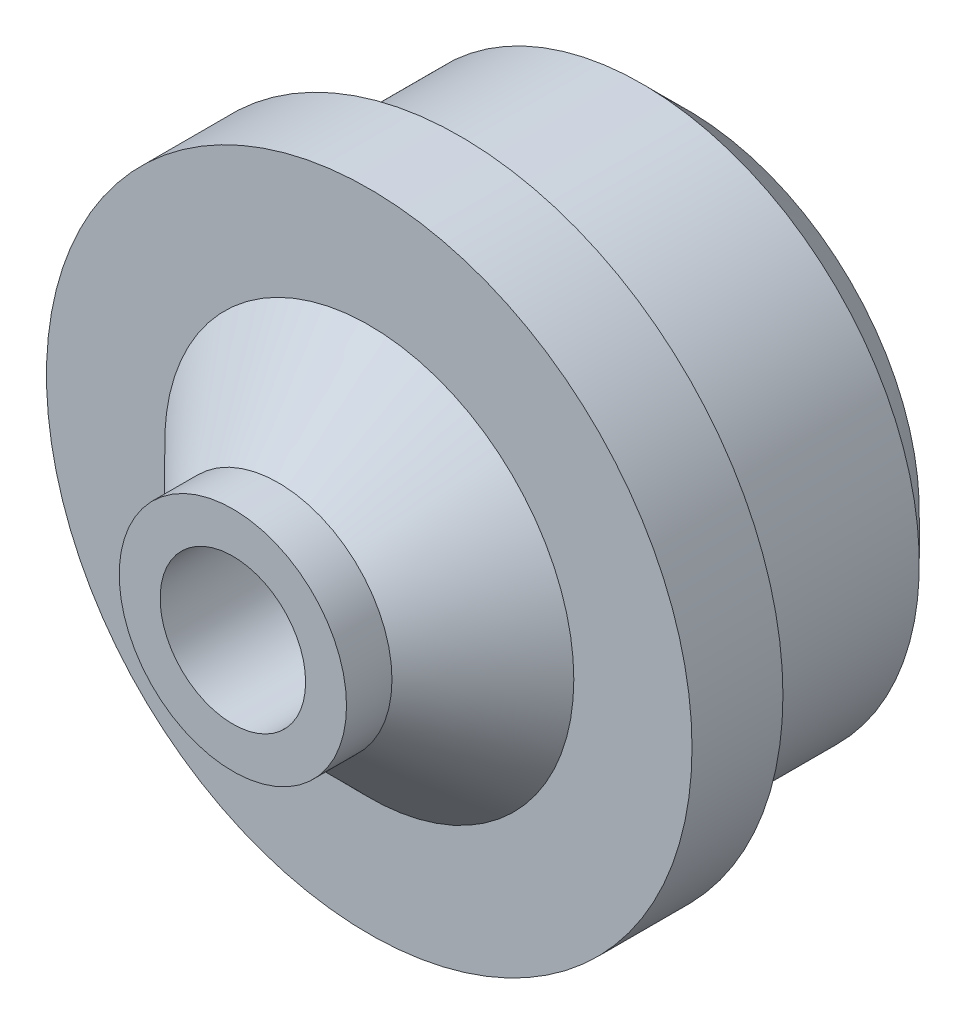
from build123d import *

# Parameters (mm, degrees)
EXTRUDE_1_DEPTH     = 5
SKETCH_2_R          = 7.1
EXTRUDE_2_DEPTH     = 2
SKETCH_3_R          = 2.5
EXTRUDE_3_DEPTH     = 7
CHAMFER_1_SIZE      = 2
SKETCH_4_R          = 1.6
CUT_EXTRUDE_1_DEPTH = 30
CHAMFER_2_SIZE      = 1
MOVE_FACE_1_BY      = 4


with BuildPart() as part:
    # ｽｹｯﾁ1 → ﾎﾞｽ - 押し出し1 (new body)
    with BuildSketch(Plane.XY):
        with BuildLine():
            Line((-6.35, -0.875), (-6.036917674, -0.875))
            ThreePointArc((-6.036917674, -0.875), (6.1, 0), (-6.036917674, 0.875))
            Line((-6.036917674, 0.875), (-6.35, 0.875))
            Line((-6.35, 0.875), (-6.35, -0.875))
        make_face()
    extrude(amount=-EXTRUDE_1_DEPTH)

    # ｽｹｯﾁ2 → ﾎﾞｽ - 押し出し2 (add)
    with BuildSketch(Plane.XY):
        Circle(SKETCH_2_R)
    extrude(amount=EXTRUDE_2_DEPTH)

    # ｽｹｯﾁ3 → ﾎﾞｽ - 押し出し3 (add)
    with BuildSketch(Plane.XY.offset(2)):
        Circle(SKETCH_3_R)
    extrude(amount=EXTRUDE_3_DEPTH)

    # 面取り1
    chamfer_1_edges = [part.edges().sort_by_distance(p)[0] for p in [
        (-2.5, 0, 2),
    ]]
    chamfer(chamfer_1_edges, length=CHAMFER_1_SIZE)

    # ｽｹｯﾁ4 → ｶｯﾄ - 押し出し1 (cut)
    with BuildSketch(Plane.XY.offset(9)):
        Circle(SKETCH_4_R)
    extrude(amount=-CUT_EXTRUDE_1_DEPTH, mode=Mode.SUBTRACT)

    # 面取り2
    chamfer_2_edges = [part.edges().sort_by_distance(p)[0] for p in [
        (6.1, 0, -5),
    ]]
    chamfer(chamfer_2_edges, length=CHAMFER_2_SIZE)

    # Move Face 1: a face moved inward by 4.0
    extrude(part.faces().sort_by_distance((0, -2, 9))[0], amount=MOVE_FACE_1_BY, dir=(0, 0, -1), mode=Mode.SUBTRACT)


solid = part.part
